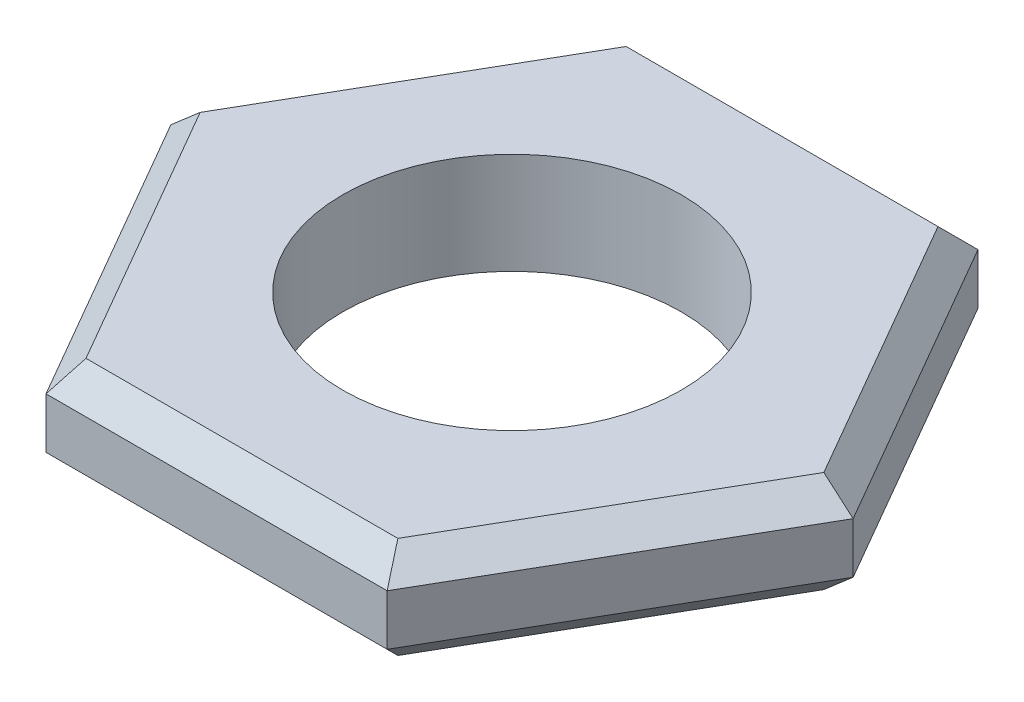
from build123d import *

# Parameters (mm, degrees)
SKETCH1_R           = 6.7818
BOSS_EXTRUDE1_DEPTH = 2.032
CHAMFER1_SIZE       = 1.016


with BuildPart() as part:
    # Sketch1 → Boss-Extrude1 (new, symmetric)
    with BuildSketch(Plane(origin=(0, 0, 0), x_dir=(1, 0, 0), z_dir=(0, 1, 0))):
        Polygon((6.833748726, 11.8364), (-6.833748726, 11.8364), (-13.667497452, 0), (-6.833748726, -11.8364), (6.833748726, -11.8364), (13.667497452, 0), align=None)
        with Locations(Location((0, 0, 0), (0, 0, 270))):
            Circle(SKETCH1_R, mode=Mode.SUBTRACT)
    extrude(amount=BOSS_EXTRUDE1_DEPTH, both=True)

    # Chamfer1
    chamfer1_edges = [part.edges().sort_by_distance(p)[0] for p in [
        (-10.250623089, 2.032, -5.9182),
        (-10.250623089, 2.032, 5.9182),
        (0, 2.032, 11.8364),
        (10.250623089, 2.032, 5.9182),
        (10.250623089, 2.032, -5.9182),
        (10.250623089, -2.032, 5.9182),
        (0, -2.032, 11.8364),
        (-10.250623089, -2.032, 5.9182),
        (-10.250623089, -2.032, -5.9182),
        (0, -2.032, -11.8364),
        (10.250623089, -2.032, -5.9182),
        (0, 2.032, -11.8364),
    ]]
    chamfer(chamfer1_edges, length=CHAMFER1_SIZE)


solid = part.part
